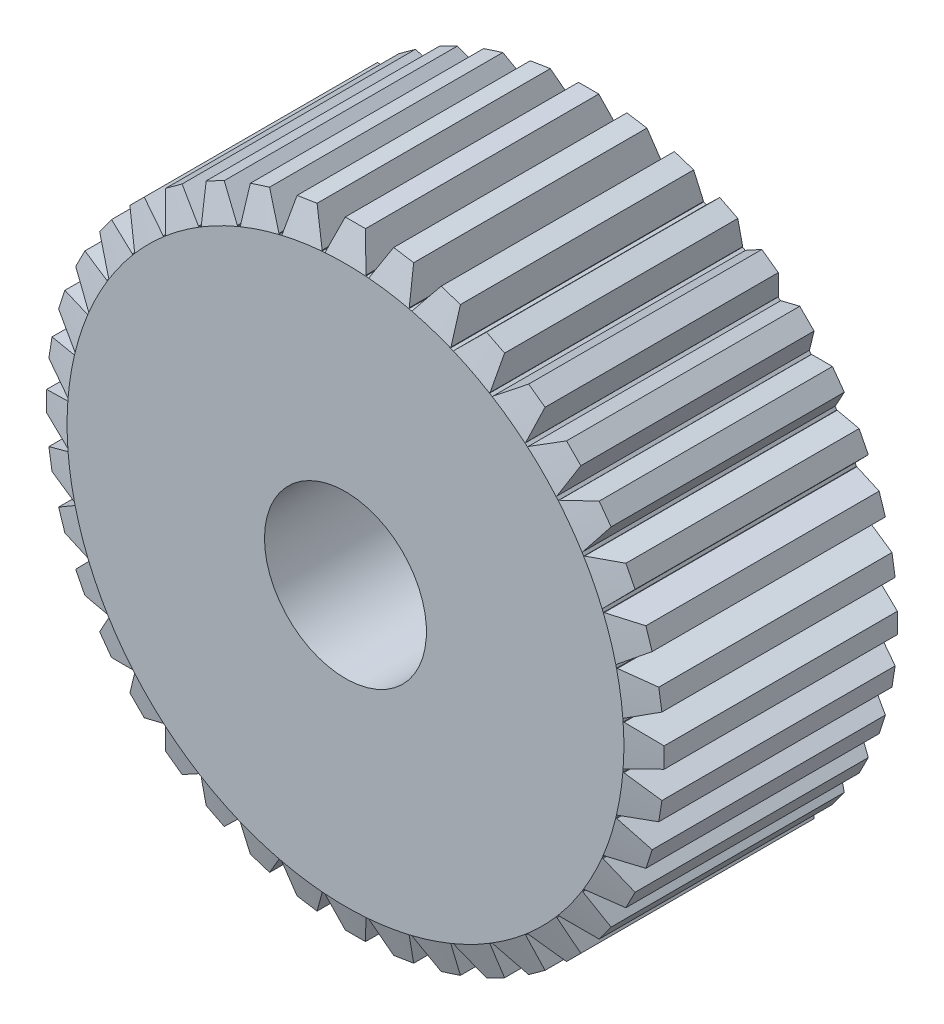
from build123d import *

# Parameters (mm, degrees)
SKETCH1_R             = 6.985
BOSS_EXTRUDE1_DEPTH   = 6.35
BOSS_EXTRUDE4_DEPTH   = 6.35
CIRPATTERN2_COUNT     = 40
SKETCH5_R             = 4.318
CUT_EXTRUDE1_DEPTH    = 1.778
F_8_32_TAPPED_HOLE1_D = 4.064


with BuildPart() as part:
    # Sketch1 → Boss-Extrude1 (new body)
    with BuildSketch(Plane.XY):
        Circle(SKETCH1_R)
    extrude(amount=-BOSS_EXTRUDE1_DEPTH)


with BuildPart() as body_2:
    # Sketch2 → Boss-Extrude4 (new, through all)
    with BuildSketch(Plane.XY):
        Polygon((-0.508, 6.985), (-0.254, 7.747), (0, 7.747), (0.254, 7.747), (0.508, 6.985), (0.508, 6.731), (-0.508, 6.731), align=None)
    extrude(amount=-BOSS_EXTRUDE4_DEPTH)


with BuildPart() as cirpattern2_1:
    # CirPattern2: pattern copy
    add(body_2.part.rotate(Axis((0, 0, 0), (0, 0, 1)), 1 * 360 / CIRPATTERN2_COUNT))


with BuildPart() as cirpattern2_2:
    # CirPattern2: pattern copy
    add(body_2.part.rotate(Axis((0, 0, 0), (0, 0, 1)), 2 * 360 / CIRPATTERN2_COUNT))


with BuildPart() as cirpattern2_3:
    # CirPattern2: pattern copy
    add(body_2.part.rotate(Axis((0, 0, 0), (0, 0, 1)), 3 * 360 / CIRPATTERN2_COUNT))


with BuildPart() as cirpattern2_4:
    # CirPattern2: pattern copy
    add(body_2.part.rotate(Axis((0, 0, 0), (0, 0, 1)), 4 * 360 / CIRPATTERN2_COUNT))


with BuildPart() as cirpattern2_5:
    # CirPattern2: pattern copy
    add(body_2.part.rotate(Axis((0, 0, 0), (0, 0, 1)), 5 * 360 / CIRPATTERN2_COUNT))


with BuildPart() as cirpattern2_6:
    # CirPattern2: pattern copy
    add(body_2.part.rotate(Axis((0, 0, 0), (0, 0, 1)), 6 * 360 / CIRPATTERN2_COUNT))


with BuildPart() as cirpattern2_7:
    # CirPattern2: pattern copy
    add(body_2.part.rotate(Axis((0, 0, 0), (0, 0, 1)), 7 * 360 / CIRPATTERN2_COUNT))


with BuildPart() as cirpattern2_8:
    # CirPattern2: pattern copy
    add(body_2.part.rotate(Axis((0, 0, 0), (0, 0, 1)), 8 * 360 / CIRPATTERN2_COUNT))


with BuildPart() as cirpattern2_9:
    # CirPattern2: pattern copy
    add(body_2.part.rotate(Axis((0, 0, 0), (0, 0, 1)), 9 * 360 / CIRPATTERN2_COUNT))


with BuildPart() as cirpattern2_10:
    # CirPattern2: pattern copy
    add(body_2.part.rotate(Axis((0, 0, 0), (0, 0, 1)), 10 * 360 / CIRPATTERN2_COUNT))


with BuildPart() as cirpattern2_11:
    # CirPattern2: pattern copy
    add(body_2.part.rotate(Axis((0, 0, 0), (0, 0, 1)), 11 * 360 / CIRPATTERN2_COUNT))


with BuildPart() as cirpattern2_12:
    # CirPattern2: pattern copy
    add(body_2.part.rotate(Axis((0, 0, 0), (0, 0, 1)), 12 * 360 / CIRPATTERN2_COUNT))


with BuildPart() as cirpattern2_13:
    # CirPattern2: pattern copy
    add(body_2.part.rotate(Axis((0, 0, 0), (0, 0, 1)), 13 * 360 / CIRPATTERN2_COUNT))


with BuildPart() as cirpattern2_14:
    # CirPattern2: pattern copy
    add(body_2.part.rotate(Axis((0, 0, 0), (0, 0, 1)), 14 * 360 / CIRPATTERN2_COUNT))


with BuildPart() as cirpattern2_15:
    # CirPattern2: pattern copy
    add(body_2.part.rotate(Axis((0, 0, 0), (0, 0, 1)), 15 * 360 / CIRPATTERN2_COUNT))


with BuildPart() as cirpattern2_16:
    # CirPattern2: pattern copy
    add(body_2.part.rotate(Axis((0, 0, 0), (0, 0, 1)), 16 * 360 / CIRPATTERN2_COUNT))


with BuildPart() as cirpattern2_17:
    # CirPattern2: pattern copy
    add(body_2.part.rotate(Axis((0, 0, 0), (0, 0, 1)), 17 * 360 / CIRPATTERN2_COUNT))


with BuildPart() as cirpattern2_18:
    # CirPattern2: pattern copy
    add(body_2.part.rotate(Axis((0, 0, 0), (0, 0, 1)), 18 * 360 / CIRPATTERN2_COUNT))


with BuildPart() as cirpattern2_19:
    # CirPattern2: pattern copy
    add(body_2.part.rotate(Axis((0, 0, 0), (0, 0, 1)), 19 * 360 / CIRPATTERN2_COUNT))


with BuildPart() as cirpattern2_20:
    # CirPattern2: pattern copy
    add(body_2.part.rotate(Axis((0, 0, 0), (0, 0, 1)), 20 * 360 / CIRPATTERN2_COUNT))


with BuildPart() as cirpattern2_21:
    # CirPattern2: pattern copy
    add(body_2.part.rotate(Axis((0, 0, 0), (0, 0, 1)), 21 * 360 / CIRPATTERN2_COUNT))


with BuildPart() as cirpattern2_22:
    # CirPattern2: pattern copy
    add(body_2.part.rotate(Axis((0, 0, 0), (0, 0, 1)), 22 * 360 / CIRPATTERN2_COUNT))


with BuildPart() as cirpattern2_23:
    # CirPattern2: pattern copy
    add(body_2.part.rotate(Axis((0, 0, 0), (0, 0, 1)), 23 * 360 / CIRPATTERN2_COUNT))


with BuildPart() as cirpattern2_24:
    # CirPattern2: pattern copy
    add(body_2.part.rotate(Axis((0, 0, 0), (0, 0, 1)), 24 * 360 / CIRPATTERN2_COUNT))


with BuildPart() as cirpattern2_25:
    # CirPattern2: pattern copy
    add(body_2.part.rotate(Axis((0, 0, 0), (0, 0, 1)), 25 * 360 / CIRPATTERN2_COUNT))


with BuildPart() as cirpattern2_26:
    # CirPattern2: pattern copy
    add(body_2.part.rotate(Axis((0, 0, 0), (0, 0, 1)), 26 * 360 / CIRPATTERN2_COUNT))


with BuildPart() as cirpattern2_27:
    # CirPattern2: pattern copy
    add(body_2.part.rotate(Axis((0, 0, 0), (0, 0, 1)), 27 * 360 / CIRPATTERN2_COUNT))


with BuildPart() as cirpattern2_28:
    # CirPattern2: pattern copy
    add(body_2.part.rotate(Axis((0, 0, 0), (0, 0, 1)), 28 * 360 / CIRPATTERN2_COUNT))


with BuildPart() as cirpattern2_29:
    # CirPattern2: pattern copy
    add(body_2.part.rotate(Axis((0, 0, 0), (0, 0, 1)), 29 * 360 / CIRPATTERN2_COUNT))


with BuildPart() as cirpattern2_30:
    # CirPattern2: pattern copy
    add(body_2.part.rotate(Axis((0, 0, 0), (0, 0, 1)), 30 * 360 / CIRPATTERN2_COUNT))


with BuildPart() as cirpattern2_31:
    # CirPattern2: pattern copy
    add(body_2.part.rotate(Axis((0, 0, 0), (0, 0, 1)), 31 * 360 / CIRPATTERN2_COUNT))


with BuildPart() as cirpattern2_32:
    # CirPattern2: pattern copy
    add(body_2.part.rotate(Axis((0, 0, 0), (0, 0, 1)), 32 * 360 / CIRPATTERN2_COUNT))


with BuildPart() as cirpattern2_33:
    # CirPattern2: pattern copy
    add(body_2.part.rotate(Axis((0, 0, 0), (0, 0, 1)), 33 * 360 / CIRPATTERN2_COUNT))


with BuildPart() as cirpattern2_34:
    # CirPattern2: pattern copy
    add(body_2.part.rotate(Axis((0, 0, 0), (0, 0, 1)), 34 * 360 / CIRPATTERN2_COUNT))


with BuildPart() as cirpattern2_35:
    # CirPattern2: pattern copy
    add(body_2.part.rotate(Axis((0, 0, 0), (0, 0, 1)), 35 * 360 / CIRPATTERN2_COUNT))


with BuildPart() as cirpattern2_36:
    # CirPattern2: pattern copy
    add(body_2.part.rotate(Axis((0, 0, 0), (0, 0, 1)), 36 * 360 / CIRPATTERN2_COUNT))


with BuildPart() as cirpattern2_37:
    # CirPattern2: pattern copy
    add(body_2.part.rotate(Axis((0, 0, 0), (0, 0, 1)), 37 * 360 / CIRPATTERN2_COUNT))


with BuildPart() as cirpattern2_38:
    # CirPattern2: pattern copy
    add(body_2.part.rotate(Axis((0, 0, 0), (0, 0, 1)), 38 * 360 / CIRPATTERN2_COUNT))


with BuildPart() as cirpattern2_39:
    # CirPattern2: pattern copy
    add(body_2.part.rotate(Axis((0, 0, 0), (0, 0, 1)), 39 * 360 / CIRPATTERN2_COUNT))


with BuildPart() as part_1:
    add(part.part)

    # Combine2: union body 2, CirPattern2_1, CirPattern2_2, CirPattern2_3, CirPattern2_4, CirPattern2_5, CirPattern2_6, CirPattern2_7, CirPattern2_8, CirPattern2_9, CirPattern2_10, CirPattern2_11, CirPattern2_12, CirPattern2_13, CirPattern2_14, CirPattern2_15, CirPattern2_16, CirPattern2_17, CirPattern2_18, CirPattern2_19, CirPattern2_20, CirPattern2_21, CirPattern2_22, CirPattern2_23, CirPattern2_24, CirPattern2_25, CirPattern2_26, CirPattern2_27, CirPattern2_28, CirPattern2_29, CirPattern2_30, CirPattern2_31, CirPattern2_32, CirPattern2_33, CirPattern2_34, CirPattern2_35, CirPattern2_36, CirPattern2_37, CirPattern2_38, CirPattern2_39
    add(body_2.part)
    add(cirpattern2_1.part)
    add(cirpattern2_2.part)
    add(cirpattern2_3.part)
    add(cirpattern2_4.part)
    add(cirpattern2_5.part)
    add(cirpattern2_6.part)
    add(cirpattern2_7.part)
    add(cirpattern2_8.part)
    add(cirpattern2_9.part)
    add(cirpattern2_10.part)
    add(cirpattern2_11.part)
    add(cirpattern2_12.part)
    add(cirpattern2_13.part)
    add(cirpattern2_14.part)
    add(cirpattern2_15.part)
    add(cirpattern2_16.part)
    add(cirpattern2_17.part)
    add(cirpattern2_18.part)
    add(cirpattern2_19.part)
    add(cirpattern2_20.part)
    add(cirpattern2_21.part)
    add(cirpattern2_22.part)
    add(cirpattern2_23.part)
    add(cirpattern2_24.part)
    add(cirpattern2_25.part)
    add(cirpattern2_26.part)
    add(cirpattern2_27.part)
    add(cirpattern2_28.part)
    add(cirpattern2_29.part)
    add(cirpattern2_30.part)
    add(cirpattern2_31.part)
    add(cirpattern2_32.part)
    add(cirpattern2_33.part)
    add(cirpattern2_34.part)
    add(cirpattern2_35.part)
    add(cirpattern2_36.part)
    add(cirpattern2_37.part)
    add(cirpattern2_38.part)
    add(cirpattern2_39.part)

    # Sketch5 → Cut-Extrude1 (cut)
    with BuildSketch(Plane(origin=(0, 0, -6.35), x_dir=(-1, 0, 0), z_dir=(0, 0, -1))):
        Circle(SKETCH5_R)
    extrude(amount=-CUT_EXTRUDE1_DEPTH, mode=Mode.SUBTRACT)

    # Sketch4 → Cut-Revolve3 (revolve, cut)
    with BuildSketch(Plane(origin=(0, 0, 0), x_dir=(0, 0, -1), z_dir=(1, 0, 0))):
        Polygon((6.096, 7.766731618), (6.096, 8.001), (6.4008, 8.001), (6.4008, 6.985), (6.35, 6.985), align=None)
    cut_revolve3 = revolve(axis=Axis((0, 0, 0), (0, 0, -1)), mode=Mode.SUBTRACT)

    # Mirror1: Cut-Revolve3 across plane
    add(cut_revolve3.mirror(Plane.XY.offset(-3.175)), mode=Mode.SUBTRACT)

    # #8-32 Tapped Hole1 (through all)
    with Locations(Plane(origin=(0, 0, -4.572), x_dir=(-1, 0, 0), z_dir=(0, 0, -1))):
        with Locations((0, 0)):
            Hole(F_8_32_TAPPED_HOLE1_D / 2)


solid = part_1.part
